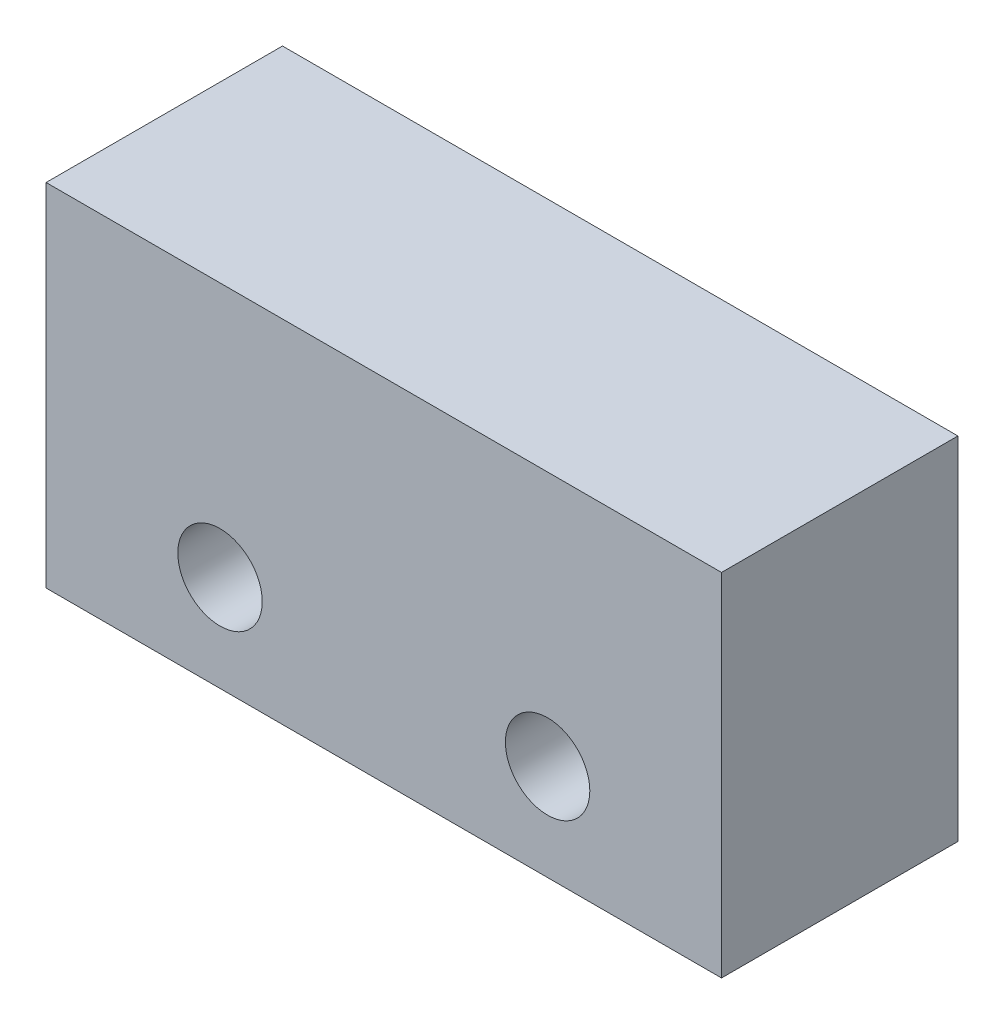
from build123d import *

# Parameters (mm, degrees)
SKETCH_1_W      = 20
SKETCH_1_H      = 10.4
SKETCH_1_R      = 1.25
EXTRUDE_1_DEPTH = 7


with BuildPart() as part:
    # 草图1 → 凸台-拉伸1 (new body)
    with BuildSketch(Plane.XY):
        with Locations((10, 5.2)):
            Rectangle(SKETCH_1_W, SKETCH_1_H)
        with Locations((5.15, 2.85)):
            Circle(SKETCH_1_R, mode=Mode.SUBTRACT)
        with Locations((14.85, 2.85)):
            Circle(SKETCH_1_R, mode=Mode.SUBTRACT)
    extrude(amount=EXTRUDE_1_DEPTH)


solid = part.part
